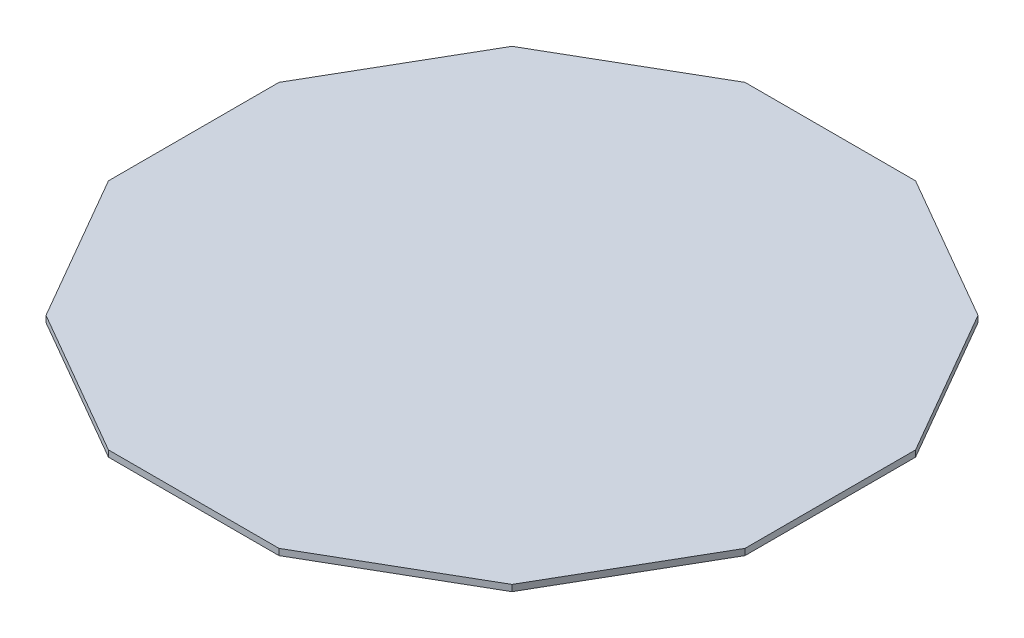
from build123d import *

# Parameters (mm, degrees)
BOSS_EXTRUDE1_DEPTH = 2.921


with BuildPart() as part:
    # Sketch1 → Boss-Extrude1 (new body)
    with BuildSketch(Plane(origin=(0, 0, 0), x_dir=(1, 0, 0), z_dir=(0, 1, 0))):
        Polygon((147.207095926, 39.444022474), (107.763073453, 107.763073453), (39.444022474, 147.207095926), (-39.444022474, 147.207095926), (-107.763073453, 107.763073453), (-147.207095926, 39.444022474), (-147.207095926, -39.444022474), (-107.763073453, -107.763073453), (-39.444022474, -147.207095926), (39.444022474, -147.207095926), (107.763073453, -107.763073453), (147.207095926, -39.444022474), align=None)
    extrude(amount=-BOSS_EXTRUDE1_DEPTH)


solid = part.part
